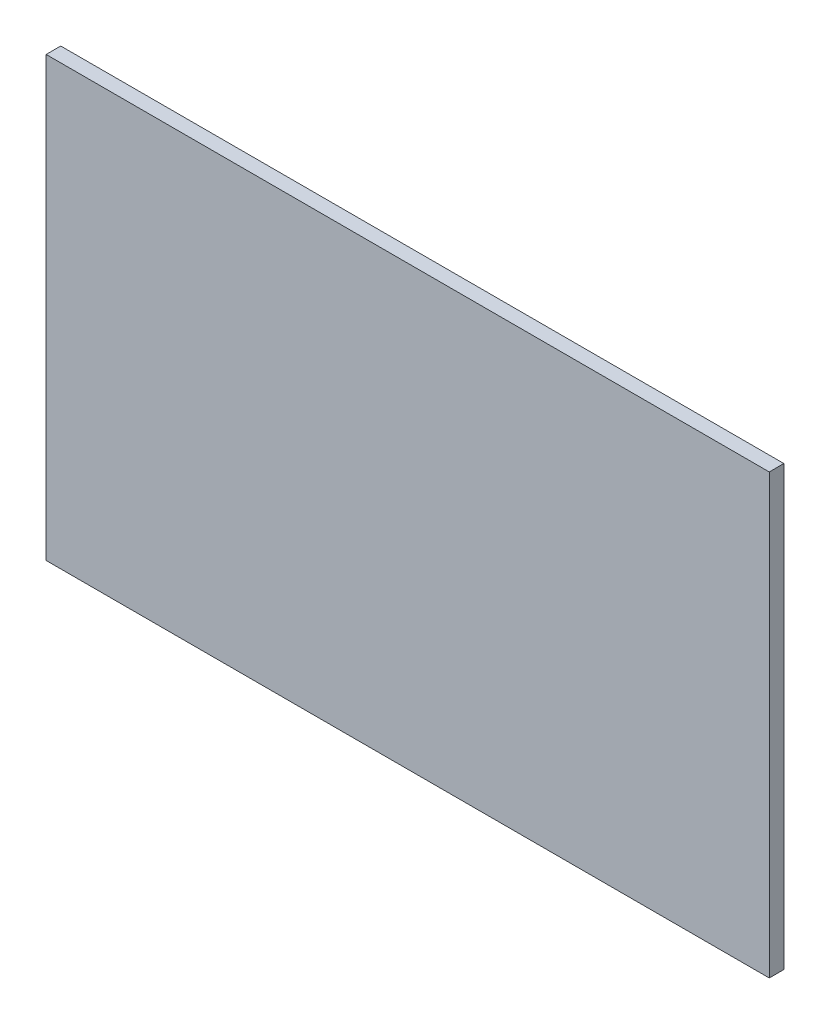
from build123d import *

# Parameters (mm, degrees)
SKETCH_1_W          = 495
SKETCH_1_H          = 500
EXTRUDE_1_DEPTH     = 10
SKETCH_2_W          = 495
SKETCH_2_H          = 200
CUT_EXTRUDE_1_DEPTH = 10


with BuildPart() as part:
    # 草图1 → 凸台-拉伸1 (new body)
    with BuildSketch(Plane.XY):
        with Locations((166.637668658, -226.70068419)):
            Rectangle(SKETCH_1_W, SKETCH_1_H)
    extrude(amount=EXTRUDE_1_DEPTH)

    # 草图2 → 切除-拉伸1 (cut)
    with BuildSketch(Plane.XY.offset(10)):
        with Locations((166.637668658, -376.70068419)):
            Rectangle(SKETCH_2_W, SKETCH_2_H)
    extrude(amount=-CUT_EXTRUDE_1_DEPTH, mode=Mode.SUBTRACT)


solid = part.part
